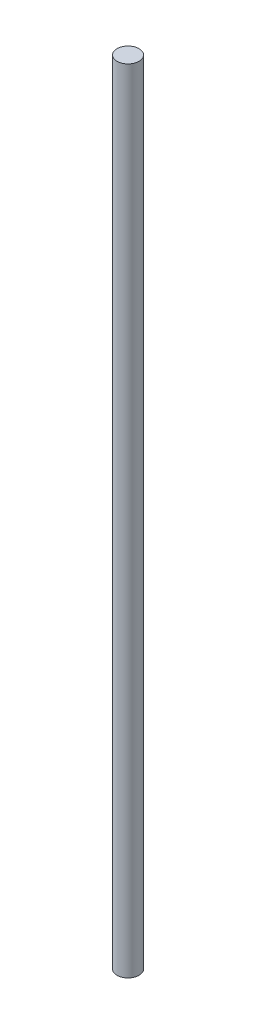
from build123d import *

# Parameters (mm, degrees)
SKETCH_1_R      = 2.5
EXTRUDE_1_DEPTH = 180


with BuildPart() as part:
    # Эскиз1 → Бобышка-Вытянуть1 (new body)
    with BuildSketch(Plane(origin=(0, 0, 0), x_dir=(1, 0, 0), z_dir=(0, 1, 0))):
        with Locations(Location((0, 0, 0), (0, 0, 90))):
            Circle(SKETCH_1_R)
    extrude(amount=EXTRUDE_1_DEPTH)


solid = part.part
